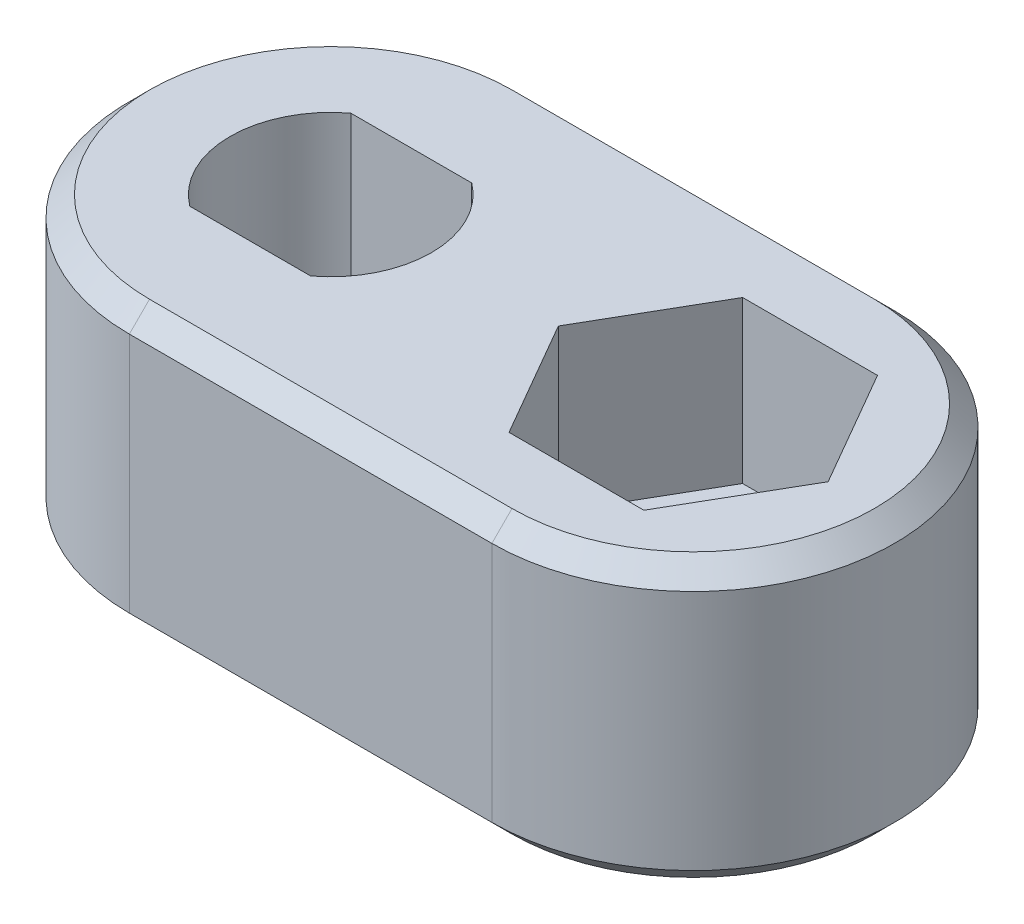
from build123d import *

# Parameters (mm, degrees)
EXTRUDE_1_DEPTH              = 7
CUT_EXTRUDE_1_DEPTH          = 4
HOLE_WIZARD_M3_1_D           = 3.4
HOLE_WIZARD_M3_1_DEPTH       = 7.5
HOLE_WIZARD_M3_1_CSINK_D     = 6.72
HOLE_WIZARD_M3_1_CSINK_ANGLE = 90
HOLE_WIZARD_M3_1_TIP         = 1.021463052
HOLE_WIZARD_1_D              = 4.15
CUT_EXTRUDE_2_DEPTH          = 4
CHAMFER_1_SIZE               = 0.5


with BuildPart() as part:
    # 草图1 → 凸台-拉伸1 (new body)
    with BuildSketch(Plane(origin=(0, 0, 0), x_dir=(1, 0, 0), z_dir=(0, 1, 0))):
        with BuildLine():
            Line((0, 5), (9, 5))
            ThreePointArc((9, 5), (14, 0), (9, -5))
            Line((9, -5), (0, -5))
            ThreePointArc((0, -5), (-5, 0), (0, 5))
        make_face()
    extrude(amount=EXTRUDE_1_DEPTH)

    # 草图2 → 切除-拉伸1 (cut)
    with BuildSketch(Plane(origin=(0, 7, 0), x_dir=(1, 0, 0), z_dir=(0, 1, 0))):
        with BuildLine():
            ThreePointArc((-1.5, 2), (-2.5, 0), (-1.5, -2))
            Line((-1.5, -2), (1.5, -2))
            ThreePointArc((1.5, -2), (2.236067977, -1.118033989), (2.5, 0))
            ThreePointArc((2.5, 0), (2.236067977, 1.118033989), (1.5, 2))
            Line((1.5, 2), (-1.5, 2))
        make_face()
    extrude(amount=-CUT_EXTRUDE_1_DEPTH, mode=Mode.SUBTRACT)

    # M3 六角凹锥坑螺钉的锥形沉头孔1
    with Locations(Plane(origin=(0, 0, 0), x_dir=(-1, 0, 0), z_dir=(0, -1, 0))):
        with Locations((0, 0)):
            CounterSinkHole(HOLE_WIZARD_M3_1_D / 2, HOLE_WIZARD_M3_1_CSINK_D / 2, depth=HOLE_WIZARD_M3_1_DEPTH, counter_sink_angle=HOLE_WIZARD_M3_1_CSINK_ANGLE)
            with Locations((0, 0, -(HOLE_WIZARD_M3_1_DEPTH + HOLE_WIZARD_M3_1_TIP / 2))):  # 118° drill point
                Cone(0, HOLE_WIZARD_M3_1_D / 2, HOLE_WIZARD_M3_1_TIP, mode=Mode.SUBTRACT)

    # 孔1 (through all)
    with Locations(Plane(origin=(0, 0, 0), x_dir=(-1, 0, 0), z_dir=(0, -1, 0))):
        with Locations((-9, 0)):
            Hole(HOLE_WIZARD_1_D / 2)

    # 草图7 → 切除-拉伸2 (cut)
    with BuildSketch(Plane(origin=(0, 7, 0), x_dir=(1, 0, 0), z_dir=(0, 1, 0))):
        Polygon((12.348631561, 0), (10.674315781, 2.9), (7.325684219, 2.9), (5.651368439, 0), (7.325684219, -2.9), (10.674315781, -2.9), align=None)
    extrude(amount=-CUT_EXTRUDE_2_DEPTH, mode=Mode.SUBTRACT)

    # 倒角1
    chamfer_1_edges = [part.edges().sort_by_distance(p)[0] for p in [
        (14, 7, 0),
        (4.5, 7, -5),
        (-5, 7, 0),
        (4.5, 0, -5),
        (14, 0, 0),
        (4.5, 0, 5),
        (-5, 0, 0),
        (4.5, 7, 5),
    ]]
    chamfer(chamfer_1_edges, length=CHAMFER_1_SIZE)


solid = part.part
